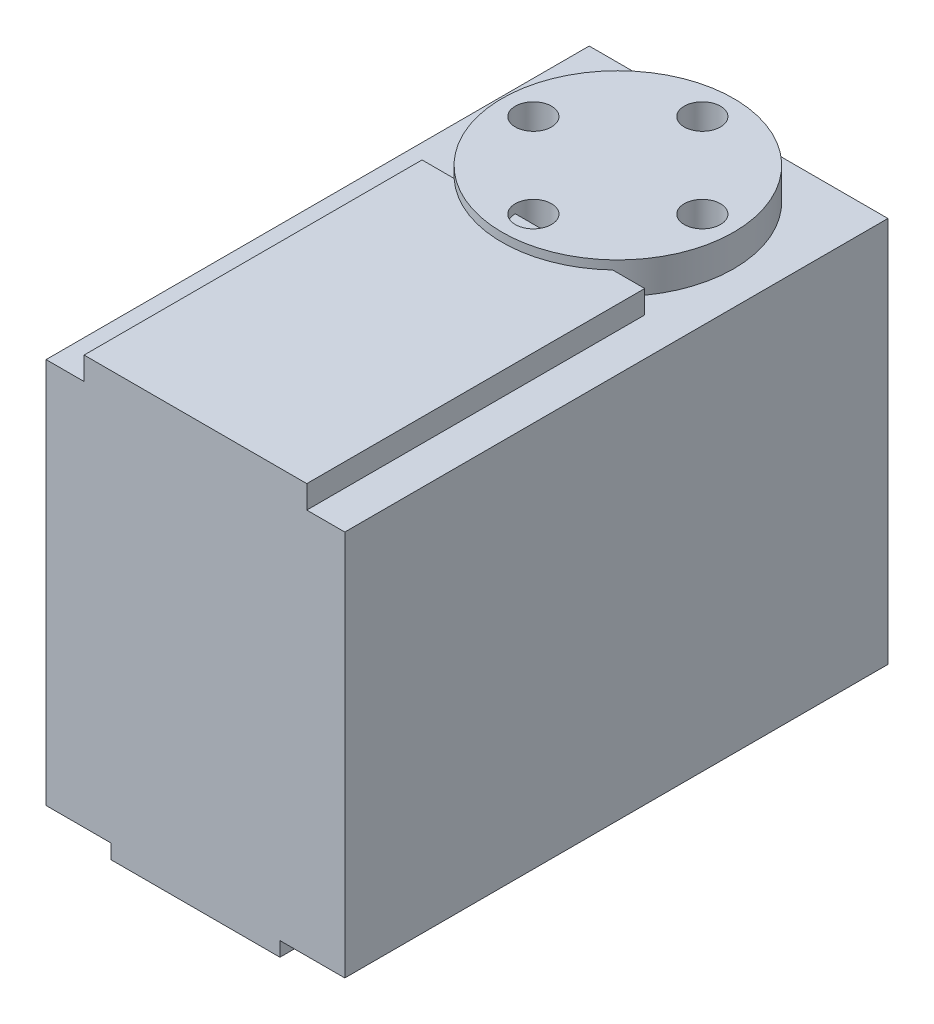
from build123d import *

# Parameters (mm, degrees)
SKETCH_1_W      = 24.75
SKETCH_1_H      = 32
EXTRUDE_1_DEPTH = 45
SKETCH_2_W      = 18.45
SKETCH_2_H      = 1.9
SKETCH_2_W_2    = 14
SKETCH_2_H_2    = 1.2
EXTRUDE_2_DEPTH = 28
SKETCH_4_R      = 9.6
SKETCH_4_R_2    = 1.5
EXTRUDE_3_DEPTH = 18.625


with BuildPart() as part:
    # 草图1 → 凸台-拉伸1 (new body)
    with BuildSketch(Plane.XY):
        with Locations((-0.370508982, -6.243263473)):
            Rectangle(SKETCH_1_W, SKETCH_1_H)
    extrude(amount=EXTRUDE_1_DEPTH)

    # 草图2 → 凸台-拉伸2 (add)
    with BuildSketch(Plane.XY.offset(45)):
        with Locations((-0.370508982, 10.706736527)):
            Rectangle(SKETCH_2_W, SKETCH_2_H)
        with Locations((-0.370508982, -22.843263473)):
            Rectangle(SKETCH_2_W_2, SKETCH_2_H_2)
    extrude(amount=-EXTRUDE_2_DEPTH)

    # 草图4 → 凸台-拉伸3 (add, symmetric)
    with BuildSketch(Plane(origin=(0, -6.243263473, 0), x_dir=(1, 0, 0), z_dir=(0, 1, 0))):
        with Locations(Location((-0.370508982, -10, 0), (0, 0, 226.816578204))):
            Circle(SKETCH_4_R)
        with Locations(Location((-0.370508982, -3, 0), (0, 0, 270))):
            Circle(SKETCH_4_R_2, mode=Mode.SUBTRACT)
        with Locations(Location((6.629491018, -10, 0), (0, 0, 270))):
            Circle(SKETCH_4_R_2, mode=Mode.SUBTRACT)
        with Locations((-0.370508982, -17)):
            Circle(SKETCH_4_R_2, mode=Mode.SUBTRACT)
        with Locations(Location((-7.370508982, -10, 0), (0, 0, 270))):
            Circle(SKETCH_4_R_2, mode=Mode.SUBTRACT)
    extrude(amount=EXTRUDE_3_DEPTH, both=True)


solid = part.part
